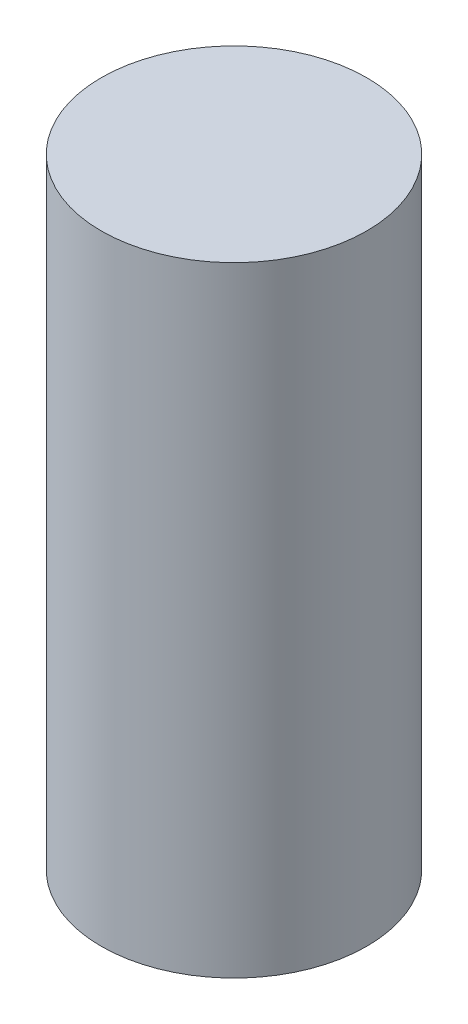
from build123d import *

# Parameters (mm, degrees)
TOPPING_AYAR_MIL_1_START = 12
SKETCH1_R                = 6
TOPPING_AYAR_MIL_1_DEPTH = 28


with BuildPart() as part:
    # Sketch1 → TOPPING_ayar_mil_1 (new body)
    with BuildSketch(Plane(origin=(0, 0, 0), x_dir=(1, 0, 0), z_dir=(0, 1, 0)).offset(TOPPING_AYAR_MIL_1_START)):
        with Locations(Location((50, 50, 0), (0, 0, 270))):
            Circle(SKETCH1_R)
    extrude(amount=TOPPING_AYAR_MIL_1_DEPTH)


solid = part.part
